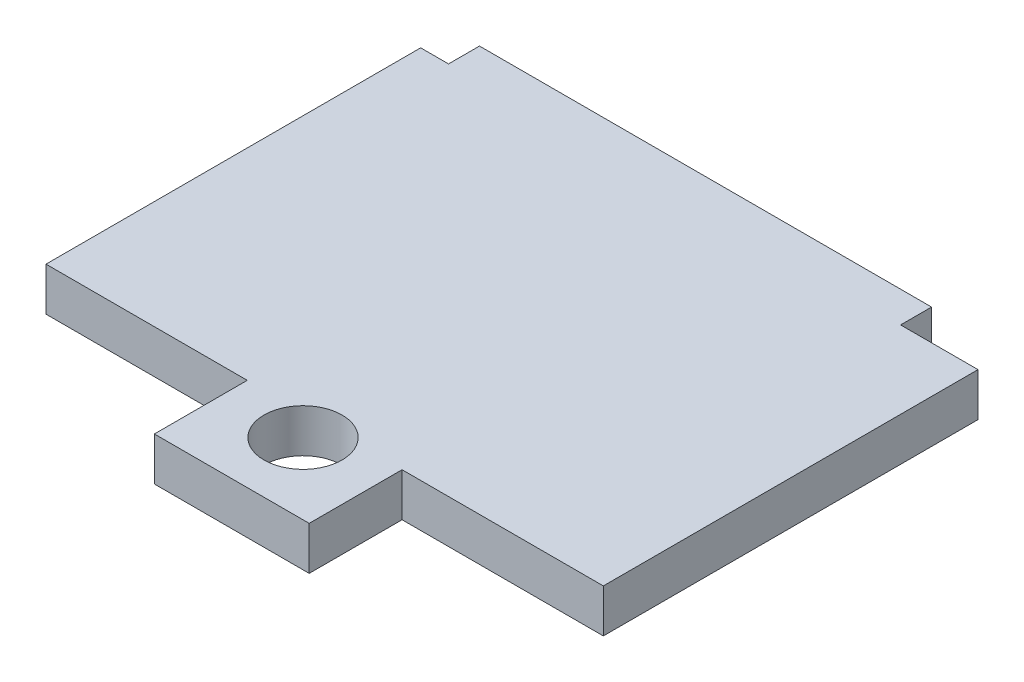
from build123d import *

# Parameters (mm, degrees)
BOSS_EXTRUDE1_DEPTH  = 1.778
M3_CLEARANCE_HOLE1_D = 3.2
SKETCH4_W            = 2.54
SKETCH4_H            = 9.144
BOSS_EXTRUDE2_DEPTH  = 1.397
CUT_EXTRUDE2_DEPTH   = 0.508


with BuildPart() as part:
    # Sketch1 → Boss-Extrude1 (new body)
    with BuildSketch(Plane(origin=(0, 0, 0), x_dir=(1, 0, 0), z_dir=(0, 1, 0))):
        Polygon((0, 15.367), (0, 0), (8.255, 0), (8.255, -3.81), (14.605, -3.81), (14.605, 0), (22.86, 0), (22.86, 15.367), (19.685, 15.367), (19.685, 16.637), (1.143, 16.637), (1.143, 15.367), align=None)
    extrude(amount=BOSS_EXTRUDE1_DEPTH)

    # M3 Clearance Hole1 (through all)
    with Locations(Plane(origin=(0, 1.778, 0), x_dir=(1, 0, 0), z_dir=(0, 1, 0))):
        with Locations((11.43, -0.888075369)):
            Hole(M3_CLEARANCE_HOLE1_D / 2)

    # Sketch4 → Boss-Extrude2 (add)
    with BuildSketch(Plane.XZ):
        with Locations((16.51, -8.874849992)):
            Rectangle(SKETCH4_W, SKETCH4_H)
        with Locations((1.27, -8.874849992)):
            Rectangle(SKETCH4_W, SKETCH4_H)
    extrude(amount=BOSS_EXTRUDE2_DEPTH)

    # Sketch6 → Cut-Extrude2 (cut)
    with BuildSketch(Plane.XZ):
        with BuildLine():
            Line((8.964425843, -6.506145501), (8.964425843, -6.909991655))
            Line((8.964425843, -6.909991655), (7.8145861, -6.909991655))
            Line((7.8145861, -6.909991655), (7.626685459, -7.739418738))
            add(Edge.make_bspline(
                [(7.626685459, -7.739418738), (7.648606423, -7.728854325), (7.693719942, -7.707112679), (7.769142894, -7.688169082), (7.851030737, -7.674840386), (7.908238664, -7.673505982), (7.937983536, -7.672812168)],
                knots=[0, 0, 0, 0, 0.906577793, 1.865744317, 2.890308309, 4, 4, 4, 4], degree=3))
            add(Edge.make_bspline(
                [(7.937983536, -7.672812168), (7.980111345, -7.673583487), (8.062822256, -7.675097845), (8.183366781, -7.692020228), (8.298234272, -7.717372224), (8.406479782, -7.755192694), (8.509339441, -7.801751485), (8.605697337, -7.860013048), (8.695453389, -7.928989075), (8.778487547, -8.007505085), (8.854165917, -8.093027855), (8.919163368, -8.185384135), (8.975505082, -8.281875885), (9.020164529, -8.38417058), (9.055450118, -8.491210086), (9.080544342, -8.603441769), (9.09649744, -8.720529357), (9.098185558, -8.800397626), (9.099041228, -8.840881078)],
                knots=[0, 0, 0, 0, 1.094894284, 2.149641875, 3.159658044, 4.149576056, 5.125966368, 6.091225838, 7.071072142, 8.064343292, 9.05924964, 10.03573454, 10.996966885, 11.96032995, 12.932910184, 13.923798045, 14.947619342, 16, 16, 16, 16], degree=3))
            add(Edge.make_bspline(
                [(9.099041228, -8.840881078), (9.098383239, -8.869169976), (9.097081627, -8.925130167), (9.090299062, -9.008339347), (9.077352393, -9.089753661), (9.060162643, -9.170001956), (9.03647652, -9.248396277), (9.00951288, -9.325978844), (8.976385896, -9.401512843), (8.938566114, -9.474966783), (8.896605369, -9.545803101), (8.850404643, -9.613162496), (8.799858378, -9.676506438), (8.744787218, -9.735304748), (8.686696523, -9.791069665), (8.624070949, -9.842345773), (8.557088462, -9.889348443), (8.486704505, -9.93259148), (8.412952724, -9.971658279), (8.335399673, -10.004004796), (8.255970657, -10.033394538), (8.172701224, -10.055400656), (8.08716146, -10.073917925), (7.998324802, -10.086206571), (7.906813972, -10.094218485), (7.844751874, -10.095325835), (7.813183856, -10.095889091)],
                knots=[0, 0, 0, 0, 1.012275937, 2.002451767, 2.98397589, 3.959820946, 4.936095762, 5.911940818, 6.896771482, 7.884012822, 8.866284557, 9.840372785, 10.804070441, 11.762530572, 12.720625922, 13.68308951, 14.655094125, 15.646011038, 16.637104318, 17.63729087, 18.650257215, 19.66446511, 20.715636712, 21.77986274, 22.870722459, 24, 24, 24, 24], degree=3))
            add(Edge.make_bspline(
                [(7.813183856, -10.095889091), (7.77762897, -10.095035495), (7.707486529, -10.093351529), (7.604467971, -10.081407543), (7.505638566, -10.061142132), (7.411417102, -10.032132436), (7.321102567, -9.995746213), (7.235464946, -9.950734351), (7.154171453, -9.897500827), (7.077117401, -9.837060483), (7.006841065, -9.768114156), (6.942061768, -9.693891209), (6.88686927, -9.611658949), (6.838316608, -9.523686685), (6.796599166, -9.429258903), (6.763410829, -9.328196567), (6.736872848, -9.220882404), (6.726265902, -9.146689634), (6.7208361, -9.108709603)],
                knots=[0, 0, 0, 0, 1.049569621, 2.070583864, 3.057046508, 4.023914414, 4.977170942, 5.927726879, 6.875021894, 7.842677272, 8.813672282, 9.777581439, 10.74592533, 11.731059957, 12.74126976, 13.788569057, 14.867946107, 16, 16, 16, 16], degree=3))
            Line((6.7208361, -9.108709603), (7.159037222, -9.108709603))
            add(Edge.make_bspline(
                [(7.159037222, -9.108709603), (7.16737716, -9.145389164), (7.18303318, -9.214245296), (7.216666832, -9.308066451), (7.252714723, -9.38786211), (7.296804542, -9.453121105), (7.347408475, -9.506688673), (7.403575233, -9.55318686), (7.465281387, -9.594896772), (7.533213517, -9.629519553), (7.604787554, -9.657569584), (7.679155398, -9.677146632), (7.754815162, -9.689456569), (7.805893242, -9.691181248), (7.831413023, -9.692042937)],
                knots=[0, 0, 0, 0, 1.385459112, 2.600831482, 3.66841355, 4.605180919, 5.48910649, 6.376050311, 7.288896949, 8.229144678, 9.181161654, 10.117453426, 11.059436513, 12, 12, 12, 12], degree=3))
            add(Edge.make_bspline(
                [(7.831413023, -9.692042937), (7.859019654, -9.691116122), (7.913523756, -9.689286301), (7.993817119, -9.678332018), (8.070607409, -9.658069522), (8.145003332, -9.631805667), (8.215705422, -9.596033203), (8.28444912, -9.554264262), (8.348727738, -9.502973174), (8.410337776, -9.445943521), (8.466766368, -9.382774188), (8.515901678, -9.314522515), (8.557816237, -9.24255902), (8.591218529, -9.166405053), (8.618327373, -9.086758421), (8.636960889, -9.003075117), (8.648586292, -8.91552995), (8.649736666, -8.855875931), (8.650323279, -8.825456398)],
                knots=[0, 0, 0, 0, 0.99750234, 1.969380735, 2.919490565, 3.862219911, 4.813679117, 5.776605688, 6.762898166, 7.778387729, 8.806918829, 9.816812977, 10.811632172, 11.809420289, 12.815921014, 13.846113939, 14.901663155, 16, 16, 16, 16], degree=3))
            add(Edge.make_bspline(
                [(8.650323279, -8.825456398), (8.649625779, -8.798315239), (8.64825618, -8.745021325), (8.638223592, -8.667130434), (8.622309886, -8.59283215), (8.599185908, -8.522824926), (8.569460902, -8.456721391), (8.532908348, -8.394944421), (8.489639644, -8.337149995), (8.440979676, -8.283150819), (8.38589553, -8.2349022), (8.32675135, -8.191720576), (8.261751219, -8.156796389), (8.193239308, -8.126910322), (8.119630861, -8.105068466), (8.042244475, -8.087468889), (7.959670244, -8.079013244), (7.90317462, -8.077456984), (7.874181452, -8.076658321)],
                knots=[0, 0, 0, 0, 1.071512717, 2.104004018, 3.095982969, 4.067795438, 5.009520676, 5.952827242, 6.895998369, 7.856350385, 8.817411605, 9.782937659, 10.74115891, 11.725120868, 12.729302161, 13.768330494, 14.854722481, 16, 16, 16, 16], degree=3))
            add(Edge.make_bspline(
                [(7.874181452, -8.076658321), (7.849388313, -8.077253323), (7.797337668, -8.078502468), (7.715887665, -8.087534706), (7.627253907, -8.101741151), (7.531576548, -8.121389444), (7.428763648, -8.146987194), (7.318690272, -8.178005391), (7.201234624, -8.214199956), (7.121097358, -8.241883089), (7.079810459, -8.256145501)],
                knots=[0, 0, 0, 0, 0.727614075, 1.527550888, 2.402655696, 3.361819828, 4.39328773, 5.511706796, 6.718025739, 8, 8, 8, 8], degree=3))
            Line((7.079810459, -8.256145501), (7.447198279, -6.506145501))
            Line((7.447198279, -6.506145501), (8.964425843, -6.506145501))
        make_face()
        with BuildLine():
            Line((11.70160533, -6.506145501), (11.70160533, -6.909991655))
            Line((11.70160533, -6.909991655), (10.551765587, -6.909991655))
            Line((10.551765587, -6.909991655), (10.363864946, -7.739418738))
            add(Edge.make_bspline(
                [(10.363864946, -7.739418738), (10.38578591, -7.728854325), (10.43089943, -7.707112679), (10.506322381, -7.688169082), (10.588210224, -7.674840386), (10.645418151, -7.673505982), (10.675163023, -7.672812168)],
                knots=[0, 0, 0, 0, 0.906577793, 1.865744317, 2.890308309, 4, 4, 4, 4], degree=3))
            add(Edge.make_bspline(
                [(10.675163023, -7.672812168), (10.717290832, -7.673583487), (10.800001743, -7.675097845), (10.920546268, -7.692020228), (11.035413759, -7.717372224), (11.143659269, -7.755192694), (11.246518929, -7.801751485), (11.342876824, -7.860013048), (11.432632877, -7.928989075), (11.515667034, -8.007505085), (11.591345405, -8.093027855), (11.656342855, -8.185384135), (11.712684569, -8.281875885), (11.757344017, -8.38417058), (11.792629605, -8.491210086), (11.817723829, -8.603441769), (11.833676927, -8.720529357), (11.835365045, -8.800397626), (11.836220715, -8.840881078)],
                knots=[0, 0, 0, 0, 1.094894284, 2.149641875, 3.159658044, 4.149576056, 5.125966368, 6.091225838, 7.071072142, 8.064343292, 9.05924964, 10.03573454, 10.996966885, 11.96032995, 12.932910184, 13.923798045, 14.947619342, 16, 16, 16, 16], degree=3))
            add(Edge.make_bspline(
                [(11.836220715, -8.840881078), (11.835562726, -8.869169976), (11.834261114, -8.925130167), (11.827478549, -9.008339347), (11.81453188, -9.089753661), (11.79734213, -9.170001956), (11.773656008, -9.248396277), (11.746692367, -9.325978844), (11.713565383, -9.401512843), (11.675745601, -9.474966783), (11.633784856, -9.545803101), (11.58758413, -9.613162496), (11.537037865, -9.676506438), (11.481966706, -9.735304748), (11.42387601, -9.791069665), (11.361250437, -9.842345773), (11.294267949, -9.889348443), (11.223883992, -9.93259148), (11.150132211, -9.971658279), (11.07257916, -10.004004796), (10.993150144, -10.033394538), (10.909880711, -10.055400656), (10.824340947, -10.073917925), (10.735504289, -10.086206571), (10.643993459, -10.094218485), (10.581931361, -10.095325835), (10.550363343, -10.095889091)],
                knots=[0, 0, 0, 0, 1.012275937, 2.002451767, 2.98397589, 3.959820946, 4.936095762, 5.911940818, 6.896771482, 7.884012822, 8.866284557, 9.840372785, 10.804070441, 11.762530572, 12.720625922, 13.68308951, 14.655094125, 15.646011038, 16.637104318, 17.63729087, 18.650257215, 19.66446511, 20.715636712, 21.77986274, 22.870722459, 24, 24, 24, 24], degree=3))
            add(Edge.make_bspline(
                [(10.550363343, -10.095889091), (10.514808457, -10.095035495), (10.444666017, -10.093351529), (10.341647458, -10.081407543), (10.242818053, -10.061142132), (10.148596589, -10.032132436), (10.058282054, -9.995746213), (9.972644433, -9.950734351), (9.89135094, -9.897500827), (9.814296888, -9.837060483), (9.744020553, -9.768114156), (9.679241255, -9.693891209), (9.624048758, -9.611658949), (9.575496095, -9.523686685), (9.533778653, -9.429258903), (9.500590316, -9.328196567), (9.474052335, -9.220882404), (9.46344539, -9.146689634), (9.458015587, -9.108709603)],
                knots=[0, 0, 0, 0, 1.049569621, 2.070583864, 3.057046508, 4.023914414, 4.977170942, 5.927726879, 6.875021894, 7.842677272, 8.813672282, 9.777581439, 10.74592533, 11.731059957, 12.74126976, 13.788569057, 14.867946107, 16, 16, 16, 16], degree=3))
            Line((9.458015587, -9.108709603), (9.896216709, -9.108709603))
            add(Edge.make_bspline(
                [(9.896216709, -9.108709603), (9.904556647, -9.145389164), (9.920212667, -9.214245296), (9.95384632, -9.308066451), (9.98989421, -9.38786211), (10.03398403, -9.453121105), (10.084587962, -9.506688673), (10.14075472, -9.55318686), (10.202460874, -9.594896772), (10.270393004, -9.629519553), (10.341967042, -9.657569584), (10.416334886, -9.677146632), (10.49199465, -9.689456569), (10.543072729, -9.691181248), (10.56859251, -9.692042937)],
                knots=[0, 0, 0, 0, 1.385459112, 2.600831482, 3.66841355, 4.605180919, 5.48910649, 6.376050311, 7.288896949, 8.229144678, 9.181161654, 10.117453426, 11.059436513, 12, 12, 12, 12], degree=3))
            add(Edge.make_bspline(
                [(10.56859251, -9.692042937), (10.596199142, -9.691116122), (10.650703243, -9.689286301), (10.730996606, -9.678332018), (10.807786896, -9.658069522), (10.882182819, -9.631805667), (10.952884909, -9.596033203), (11.021628607, -9.554264262), (11.085907225, -9.502973174), (11.147517263, -9.445943521), (11.203945855, -9.382774188), (11.253081165, -9.314522515), (11.294995724, -9.24255902), (11.328398016, -9.166405053), (11.355506861, -9.086758421), (11.374140376, -9.003075117), (11.385765779, -8.91552995), (11.386916153, -8.855875931), (11.387502766, -8.825456398)],
                knots=[0, 0, 0, 0, 0.99750234, 1.969380735, 2.919490565, 3.862219911, 4.813679117, 5.776605688, 6.762898166, 7.778387729, 8.806918829, 9.816812977, 10.811632172, 11.809420289, 12.815921014, 13.846113939, 14.901663155, 16, 16, 16, 16], degree=3))
            add(Edge.make_bspline(
                [(11.387502766, -8.825456398), (11.386805266, -8.798315239), (11.385435667, -8.745021325), (11.375403079, -8.667130434), (11.359489373, -8.59283215), (11.336365395, -8.522824926), (11.306640389, -8.456721391), (11.270087835, -8.394944421), (11.226819132, -8.337149995), (11.178159164, -8.283150819), (11.123075017, -8.2349022), (11.063930837, -8.191720576), (10.998930707, -8.156796389), (10.930418795, -8.126910322), (10.856810348, -8.105068466), (10.779423962, -8.087468889), (10.696849731, -8.079013244), (10.640354107, -8.077456984), (10.611360939, -8.076658321)],
                knots=[0, 0, 0, 0, 1.071512717, 2.104004018, 3.095982969, 4.067795438, 5.009520676, 5.952827242, 6.895998369, 7.856350385, 8.817411605, 9.782937659, 10.74115891, 11.725120868, 12.729302161, 13.768330494, 14.854722481, 16, 16, 16, 16], degree=3))
            add(Edge.make_bspline(
                [(10.611360939, -8.076658321), (10.5865678, -8.077253323), (10.534517155, -8.078502468), (10.453067152, -8.087534706), (10.364433394, -8.101741151), (10.268756035, -8.121389444), (10.165943135, -8.146987194), (10.055869759, -8.178005391), (9.938414111, -8.214199956), (9.858276845, -8.241883089), (9.816989946, -8.256145501)],
                knots=[0, 0, 0, 0, 0.727614075, 1.527550888, 2.402655696, 3.361819828, 4.39328773, 5.511706796, 6.718025739, 8, 8, 8, 8], degree=3))
            Line((9.816989946, -8.256145501), (10.184377766, -6.506145501))
            Line((10.184377766, -6.506145501), (11.70160533, -6.506145501))
        make_face()
    extrude(amount=-CUT_EXTRUDE2_DEPTH, mode=Mode.SUBTRACT)


solid = part.part
